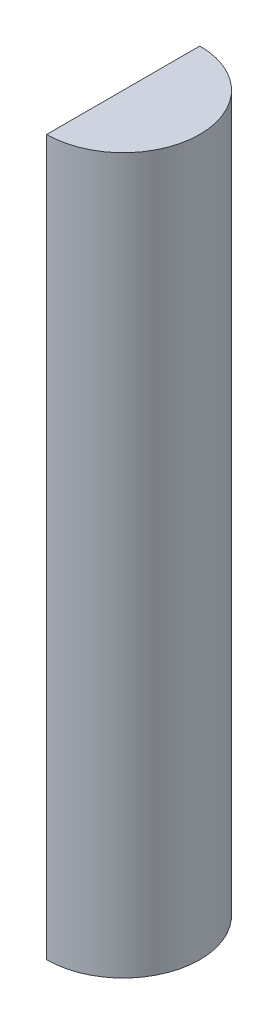
from build123d import *

# Parameters (mm, degrees)
BOSS_EXTRUDE4_DEPTH = 177.8


with BuildPart() as part:
    # Sketch2 → Boss-Extrude4 (new body)
    with BuildSketch(Plane(origin=(0, 0, 0), x_dir=(1, 0, 0), z_dir=(0, 1, 0))):
        with BuildLine():
            Line((0, 19.05), (0, -19.05))
            ThreePointArc((0, -19.05), (19.05, 0), (0, 19.05))
        make_face()
    extrude(amount=BOSS_EXTRUDE4_DEPTH)


solid = part.part
